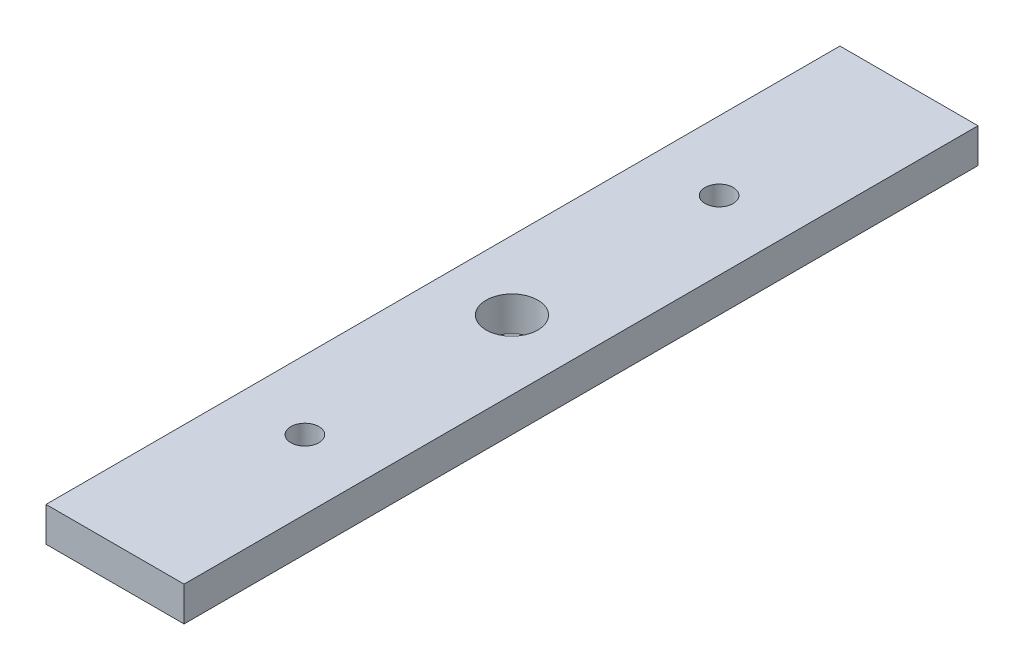
from build123d import *

# Parameters (mm, degrees)
SKETCH1_W               = 50.8
SKETCH1_H               = 292.1
EXTRUDE1_DEPTH          = 12.7
F_3_8_CLEARANCE_HOLE1_D = 10.31748
SKETCH4_R               = 9.525
CUT_EXTRUDE1_DEPTH      = 297.756364717


with BuildPart() as part:
    # Sketch1 → Extrude1 (new body)
    with BuildSketch(Plane(origin=(0, 0, 0), x_dir=(1, 0, 0), z_dir=(0, 1, 0))):
        with Locations((25.4, 146.05)):
            Rectangle(SKETCH1_W, SKETCH1_H)
    extrude(amount=EXTRUDE1_DEPTH)

    # 3/8 Clearance Hole1 (through all)
    with Locations(Plane(origin=(0, 12.7, 0), x_dir=(-1, 0, 0), z_dir=(0, 1, 0))):
        with Locations((-25.4, -69.85), (-25.4, -222.25)):
            Hole(F_3_8_CLEARANCE_HOLE1_D / 2)

    # Sketch4 → Cut-Extrude1 (cut, through all)
    with BuildSketch(Plane.XZ):
        with Locations(Location((25.4, -146.05, 0), (0, 0, 270))):
            Circle(SKETCH4_R)
    extrude(amount=-CUT_EXTRUDE1_DEPTH, mode=Mode.SUBTRACT)


solid = part.part
